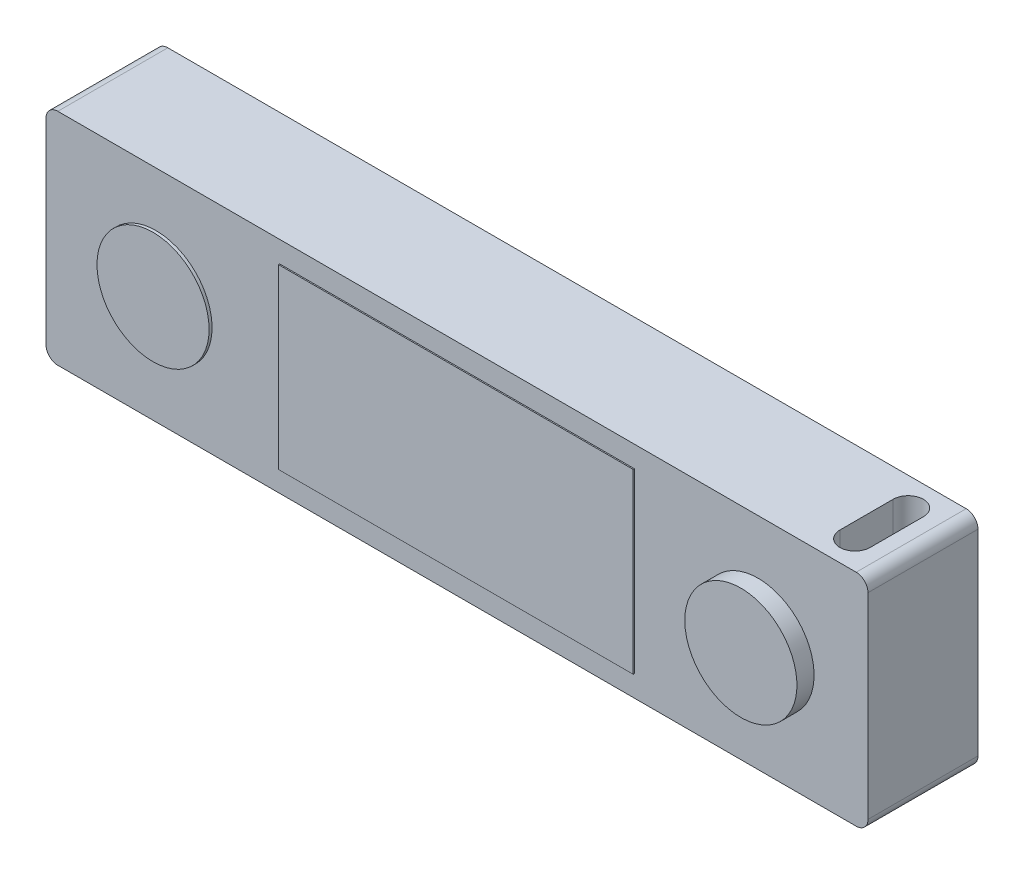
from build123d import *

# Parameters (mm, degrees)
ESQUISSE1_W                  = 69.5
ESQUISSE1_H                  = 18.6
BOSS_EXTRU_1_DEPTH           = 9.3
ENL_V_MAT_EXTRU_1_DEPTH      = 41.497067795
ENL_V_MAT_EXTRU_1_DEPTH_BACK = 41.497067795
CONG_1_R                     = 1
ESQUISSE3_R                  = 4.74
BOSS_EXTRU_2_DEPTH           = 1.45
ESQUISSE4_R                  = 4.74
BOSS_EXTRU_3_DEPTH           = 0.25
ESQUISSE5_W                  = 30
ESQUISSE5_H                  = 15
BOSS_EXTRU_4_DEPTH           = 0.1


with BuildPart() as part:
    # Esquisse1 → Boss.-Extru.1 (new body)
    with BuildSketch(Plane.XY):
        Rectangle(ESQUISSE1_W, ESQUISSE1_H)
    extrude(amount=BOSS_EXTRU_1_DEPTH)

    # Esquisse2 → Enlèv. mat.-Extru.1 (cut, two sides: drawn at the far end of the back side and taken through both)
    with BuildSketch(Plane(origin=(0, 9.3, 0), x_dir=(1, 0, 0), z_dir=(0, 1, 0)).offset(-ENL_V_MAT_EXTRU_1_DEPTH_BACK)):
        with BuildLine():
            Line((29.971199051, -6.900645436), (29.971199051, -2.399354564))
            ThreePointArc((29.971199051, -2.399354564), (31.250676471, -1.119877145), (32.53015389, -2.399354564))
            Line((32.53015389, -2.399354564), (32.53015389, -6.900645436))
            ThreePointArc((32.53015389, -6.900645436), (31.250676471, -8.180122855), (29.971199051, -6.900645436))
        make_face()
    extrude(amount=ENL_V_MAT_EXTRU_1_DEPTH + ENL_V_MAT_EXTRU_1_DEPTH_BACK, mode=Mode.SUBTRACT)

    # Congé1
    cong_1_edges = [part.edges().sort_by_distance(p)[0] for p in [
        (34.75, -9.3, 4.65),
        (-34.75, -9.3, 4.65),
        (-34.75, 9.3, 4.65),
        (34.75, 9.3, 4.65),
    ]]
    fillet(cong_1_edges, radius=CONG_1_R)

    # Esquisse3 → Boss.-Extru.2 (add)
    with BuildSketch(Plane.XY.offset(9.3)):
        with Locations(Location((25.450020764, -0.023971243, 0), (0, 0, 180))):
            Circle(ESQUISSE3_R)
    extrude(amount=BOSS_EXTRU_2_DEPTH)

    # Esquisse4 → Boss.-Extru.3 (add)
    with BuildSketch(Plane.XY.offset(9.3)):
        with Locations(Location((-25.450020764, -0.023971243, 0), (0, 0, 180))):
            Circle(ESQUISSE4_R)
    extrude(amount=BOSS_EXTRU_3_DEPTH)

    # Esquisse5 → Boss.-Extru.4 (add)
    with BuildSketch(Plane.XY.offset(9.3)):
        Rectangle(ESQUISSE5_W, ESQUISSE5_H)
    extrude(amount=BOSS_EXTRU_4_DEPTH)


solid = part.part
